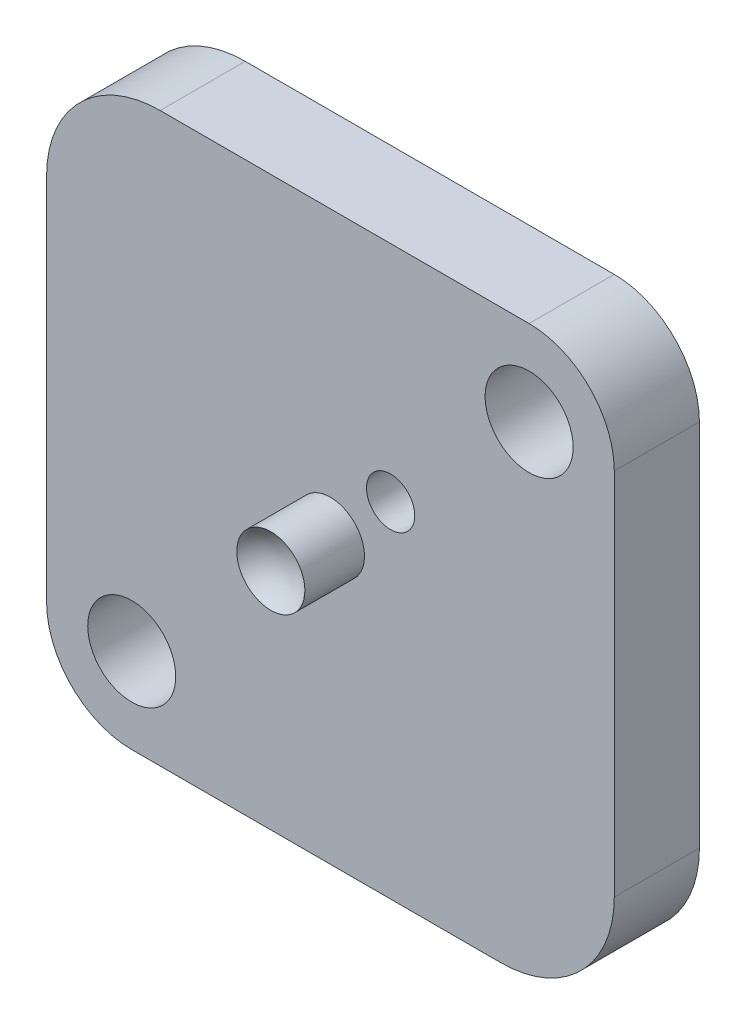
from build123d import *

# Parameters (mm, degrees)
SKETCH1_W           = 100
SKETCH1_H           = 100
BOSS_EXTRUDE1_DEPTH = 15
SKETCH2_R           = 7.75
CUT_EXTRUDE1_DEPTH  = 73.284161474
SKETCH5_R           = 6
BOSS_EXTRUDE6_DEPTH = 10.5
SKETCH6_R           = 4.25
CUT_EXTRUDE3_DEPTH  = 73.284161474
FILLET1_R           = 20
FILLET2_R           = 15
DOME2_FACE_RADIUS   = 6
DOME2_HEIGHT        = 3


with BuildPart() as part:
    # Sketch1 → Boss-Extrude1 (new body)
    with BuildSketch(Plane.XY):
        Rectangle(SKETCH1_W, SKETCH1_H)
    extrude(amount=BOSS_EXTRUDE1_DEPTH)

    # Sketch2 → Cut-Extrude1 (cut, through all)
    with BuildSketch(Plane.XY.offset(15)):
        with Locations((35, 35)):
            Circle(SKETCH2_R)
        with Locations(Location((-35, -35, 0), (0, 0, 180))):
            Circle(SKETCH2_R)
    extrude(amount=-CUT_EXTRUDE1_DEPTH, mode=Mode.SUBTRACT)

    # Sketch5 → Boss-Extrude6 (add)
    with BuildSketch(Plane.XY.offset(15)):
        with Locations(Location((0, 0, 0), (0, 0, 180))):
            Circle(SKETCH5_R)
    extrude(amount=BOSS_EXTRUDE6_DEPTH)

    # Sketch6 → Cut-Extrude3 (cut, through all)
    with BuildSketch(Plane.XY.offset(15)):
        with Locations((10.606601718, 10.606601718)):
            Circle(SKETCH6_R)
        with Locations(Location((-10.606601718, -10.606601718, 0), (0, 0, 180))):
            Circle(SKETCH6_R)
    extrude(amount=-CUT_EXTRUDE3_DEPTH, mode=Mode.SUBTRACT)

    # Fillet1
    fillet1_edges = [part.edges().sort_by_distance(p)[0] for p in [
        (-50, 50, 7.5),
        (50, -50, 7.5),
    ]]
    fillet(fillet1_edges, radius=FILLET1_R)

    # Fillet2
    fillet2_edges = [part.edges().sort_by_distance(p)[0] for p in [
        (50, 50, 7.5),
        (-50, -50, 7.5),
    ]]
    fillet(fillet2_edges, radius=FILLET2_R)

    # Dome2: a dome of height H over a round flat face of radius A is a cap of a sphere of radius (A * A + H * H) / (2 * H)
    dome2_r = (DOME2_FACE_RADIUS * DOME2_FACE_RADIUS + DOME2_HEIGHT * DOME2_HEIGHT) / (2 * DOME2_HEIGHT)
    dome2_base = Plane((0, 0, 25.5), z_dir=(0, 0, -1))
    with Locations(dome2_base.offset(DOME2_HEIGHT - dome2_r)):
        dome2_ball = Sphere(dome2_r, mode=Mode.PRIVATE)
    add(split(dome2_ball, bisect_by=dome2_base, keep=Keep.TOP, mode=Mode.PRIVATE), mode=Mode.SUBTRACT)


solid = part.part
